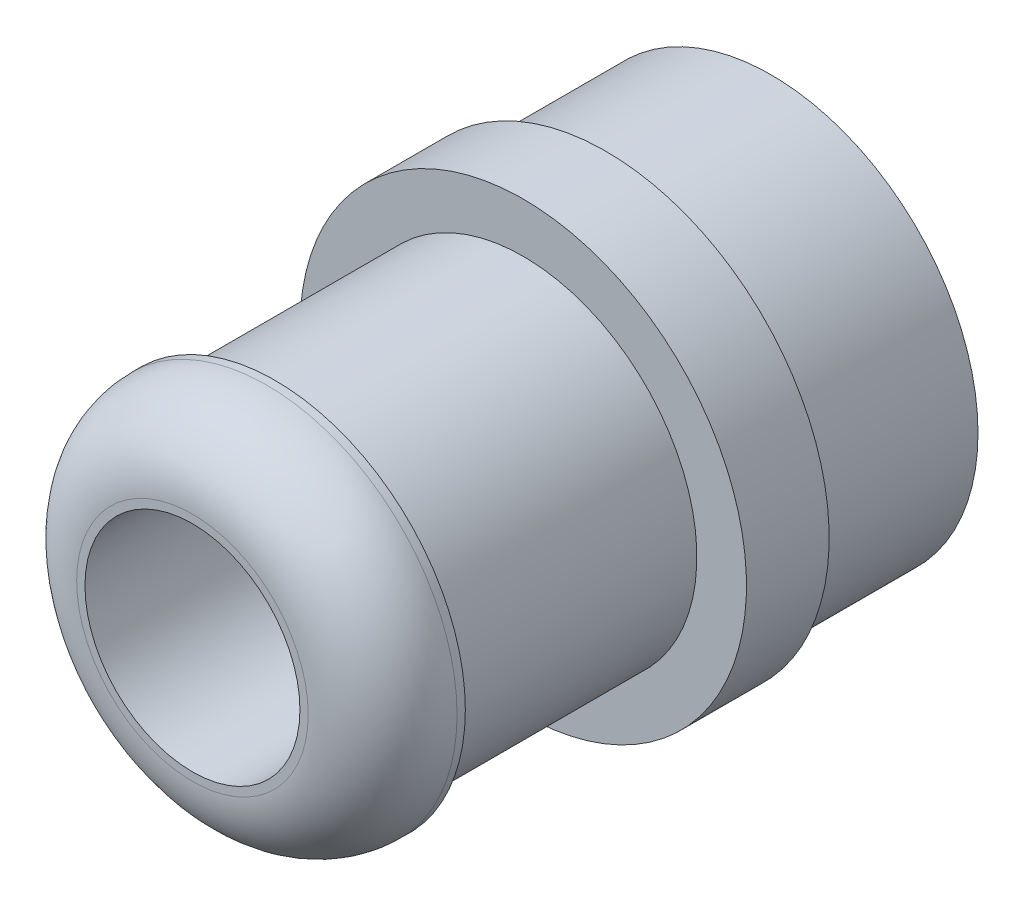
from build123d import *

# Parameters (mm, degrees)
SKETCH1_R           = 2.1
SKETCH1_R_2         = 1.3
BOSS_EXTRUDE1_DEPTH = 7
SKETCH2_R           = 2.5
SKETCH2_R_2         = 2.1
BOSS_EXTRUDE2_DEPTH = 3
BOSS_EXTRUDE3_START = -1
SKETCH3_R           = 2.3
SKETCH3_R_2         = 2.1
BOSS_EXTRUDE3_DEPTH = 1
BOSS_EXTRUDE4_START = -2
SKETCH4_R           = 2.7
SKETCH4_R_2         = 2.5
BOSS_EXTRUDE4_DEPTH = 1
FILLET1_R           = 0.9


with BuildPart() as part:
    # Sketch1 → Boss-Extrude1 (new body)
    with BuildSketch(Plane.XY):
        Circle(SKETCH1_R)
        Circle(SKETCH1_R_2, mode=Mode.SUBTRACT)
    extrude(amount=BOSS_EXTRUDE1_DEPTH)

    # Sketch2 → Boss-Extrude2 (add)
    with BuildSketch(Plane(origin=(0, 0, 0), x_dir=(-1, 0, 0), z_dir=(0, 0, -1))):
        Circle(SKETCH2_R)
        Circle(SKETCH2_R_2, mode=Mode.SUBTRACT)
    extrude(amount=-BOSS_EXTRUDE2_DEPTH)

    # Sketch3 → Boss-Extrude3 (add)
    with BuildSketch(Plane.XY.offset(7).offset(BOSS_EXTRUDE3_START)):
        Circle(SKETCH3_R)
        with Locations(Location((0, 0, 0), (0, 0, 180))):
            Circle(SKETCH3_R_2, mode=Mode.SUBTRACT)
    extrude(amount=BOSS_EXTRUDE3_DEPTH)

    # Sketch4 → Boss-Extrude4 (add)
    with BuildSketch(Plane(origin=(0, 0, 0), x_dir=(-1, 0, 0), z_dir=(0, 0, -1)).offset(BOSS_EXTRUDE4_START)):
        Circle(SKETCH4_R)
        Circle(SKETCH4_R_2, mode=Mode.SUBTRACT)
    extrude(amount=-BOSS_EXTRUDE4_DEPTH)

    # Fillet1
    fillet1_edges = [part.edges().sort_by_distance(p)[0] for p in [
        (-2.3, 0, 7),
    ]]
    fillet(fillet1_edges, radius=FILLET1_R)


solid = part.part
